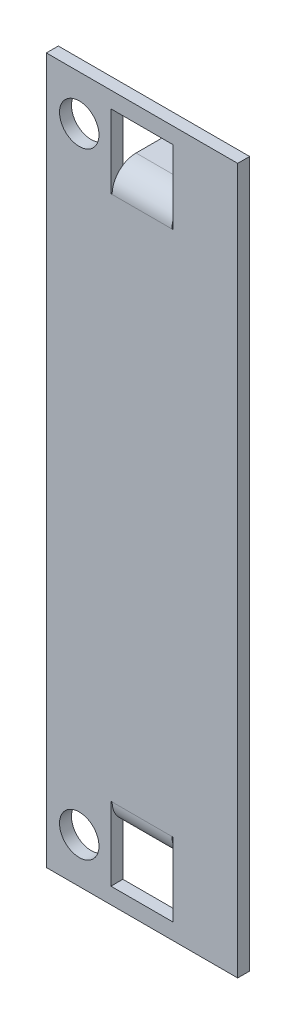
from build123d import *

# Parameters (mm, degrees)
CLAMP_BAR_SKETCH_W       = 32
CLAMP_BAR_SKETCH_H       = 118
CLAMP_BAR_DEPTH          = 2
FINGER_RELIEF_SKETCH_W   = 10.4
FINGER_RELIEF_SKETCH_H   = 12.3
FINGER_RELIEFS_DEPTH     = 2.4
FOLDED_FINGERS_DEPTH     = 10
STUD_CLEARANCES_SKETCH_R = 3.3
STUD_CLEARANCES_DEPTH    = 2.4


with BuildPart() as part:
    # Clamp Bar Sketch → Clamp Bar (new body)
    with BuildSketch(Plane.XY.offset(140)):
        with Locations((-7.5, 0)):
            Rectangle(CLAMP_BAR_SKETCH_W, CLAMP_BAR_SKETCH_H)
    extrude(amount=CLAMP_BAR_DEPTH)

    # Finger Relief Sketch → Finger Reliefs (cut)
    with BuildSketch(Plane.XY.offset(139.8)):
        with Locations((-7.5, -50.15)):
            Rectangle(FINGER_RELIEF_SKETCH_W, FINGER_RELIEF_SKETCH_H)
        with Locations((-7.5, 50.15)):
            Rectangle(FINGER_RELIEF_SKETCH_W, FINGER_RELIEF_SKETCH_H)
    extrude(amount=FINGER_RELIEFS_DEPTH, mode=Mode.SUBTRACT)

    # Folded Finger Sketch → Folded Fingers (add)
    with BuildSketch(Plane(origin=(-12.5, 0, 0), x_dir=(0, 0, -1), z_dir=(1, 0, 0))):
        with BuildLine():
            Line((-138, -48), (-130, -48))
            Line((-130, -48), (-130, -46))
            Line((-130, -46), (-138, -46))
            ThreePointArc((-138, -46), (-139.414213562, -45.414213562), (-140, -44))
            Line((-140, -44), (-142, -44))
            ThreePointArc((-142, -44), (-140.828427125, -46.828427125), (-138, -48))
        make_face()
        with BuildLine():
            Line((-138, 48), (-130, 48))
            Line((-130, 48), (-130, 46))
            Line((-130, 46), (-138, 46))
            ThreePointArc((-138, 46), (-139.414213562, 45.414213562), (-140, 44))
            Line((-140, 44), (-142, 44))
            ThreePointArc((-142, 44), (-140.828427125, 46.828427125), (-138, 48))
        make_face()
    extrude(amount=FOLDED_FINGERS_DEPTH)

    # Stud Clearances Sketch → Stud Clearances (cut)
    with BuildSketch(Plane.XY.offset(139.8)):
        with Locations((-18, -51.5)):
            Circle(STUD_CLEARANCES_SKETCH_R)
        with Locations((-18, 51.5)):
            Circle(STUD_CLEARANCES_SKETCH_R)
    extrude(amount=STUD_CLEARANCES_DEPTH, mode=Mode.SUBTRACT)


solid = part.part
